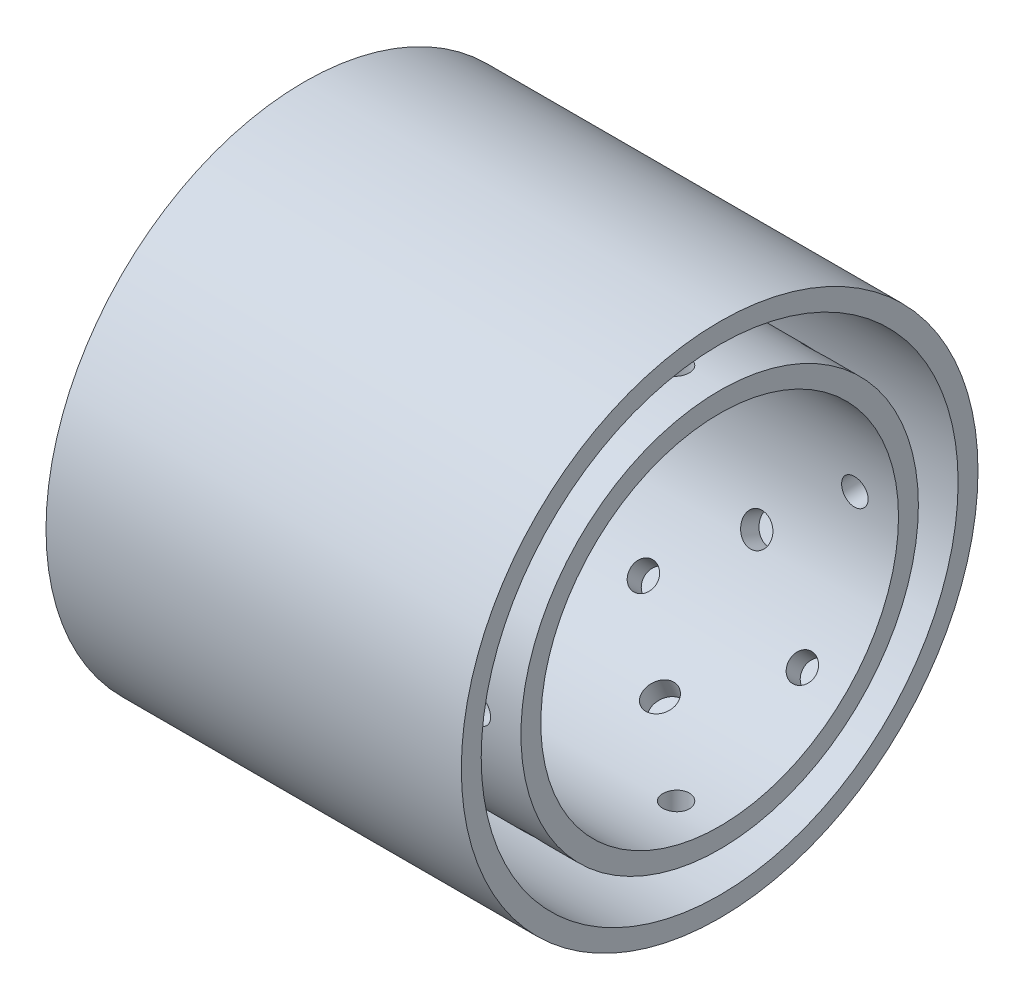
from build123d import *

# Parameters (mm, degrees)
SKETCH1_R           = 100
SKETCH1_R_2         = 90
BOSS_EXTRUDE1_DEPTH = 209
SKETCH2_R           = 6.671924433
CUT_EXTRUDE1_DEPTH  = 209
CIRPATTERN1_COUNT   = 8
SKETCH3_R           = 7.580251625
CUT_EXTRUDE2_DEPTH  = 209
CIRPATTERN2_COUNT   = 8
SKETCH4_R           = 130
SKETCH4_R_2         = 120
BOSS_EXTRUDE3_DEPTH = 209


with BuildPart() as part:
    # Sketch1 → Boss-Extrude1 (new body)
    with BuildSketch(Plane(origin=(0, 0, 0), x_dir=(0, 0, -1), z_dir=(1, 0, 0))):
        Circle(SKETCH1_R)
        Circle(SKETCH1_R_2, mode=Mode.SUBTRACT)
    extrude(amount=BOSS_EXTRUDE1_DEPTH)

    # Sketch2 → Cut-Extrude1 (cut)
    with BuildSketch(Plane(origin=(0, 0, 0), x_dir=(1, 0, 0), z_dir=(0, 1, 0))):
        with Locations(Location((27.047659841, 0, 0), (0, 0, 270))):
            Circle(SKETCH2_R)
        with Locations(Location((107.047659841, 0, 0), (0, 0, 270))):
            Circle(SKETCH2_R)
        with Locations(Location((187.047659841, 0, 0), (0, 0, 270))):
            Circle(SKETCH2_R)
    cut_extrude1 = extrude(amount=-CUT_EXTRUDE1_DEPTH, mode=Mode.SUBTRACT)

    # CirPattern1: Cut-Extrude1 ×8 about axis
    cirpattern1_axis = Axis((0, 0, 0), (1, 0, 0))
    for i in range(1, CIRPATTERN1_COUNT):
        add(cut_extrude1.rotate(cirpattern1_axis, i * 360 / CIRPATTERN1_COUNT), mode=Mode.SUBTRACT)

    # Sketch3 → Cut-Extrude2 (cut)
    with BuildSketch(Plane(origin=(0, 0, 0), x_dir=(-1, 0, 0), z_dir=(0, -0.9238795325112868, -0.3826834323650895))):
        with Locations(Location((-64.553150975, 0, 0), (0, 0, 90))):
            Circle(SKETCH3_R)
        with Locations(Location((-144.553150975, 0, 0), (0, 0, 90))):
            Circle(SKETCH3_R)
    cut_extrude2 = extrude(amount=-CUT_EXTRUDE2_DEPTH, mode=Mode.SUBTRACT)

    # CirPattern2: Cut-Extrude2 ×8 about axis
    cirpattern2_axis = Axis((0, 0, 0), (1, 0, 0))
    for i in range(1, CIRPATTERN2_COUNT):
        add(cut_extrude2.rotate(cirpattern2_axis, i * 360 / CIRPATTERN2_COUNT), mode=Mode.SUBTRACT)


with BuildPart() as body_2:
    # Sketch4 → Boss-Extrude3 (new body)
    with BuildSketch(Plane.ZY):
        Circle(SKETCH4_R)
        Circle(SKETCH4_R_2, mode=Mode.SUBTRACT)
    extrude(amount=-BOSS_EXTRUDE3_DEPTH)


solid = Compound([part.part, body_2.part])
